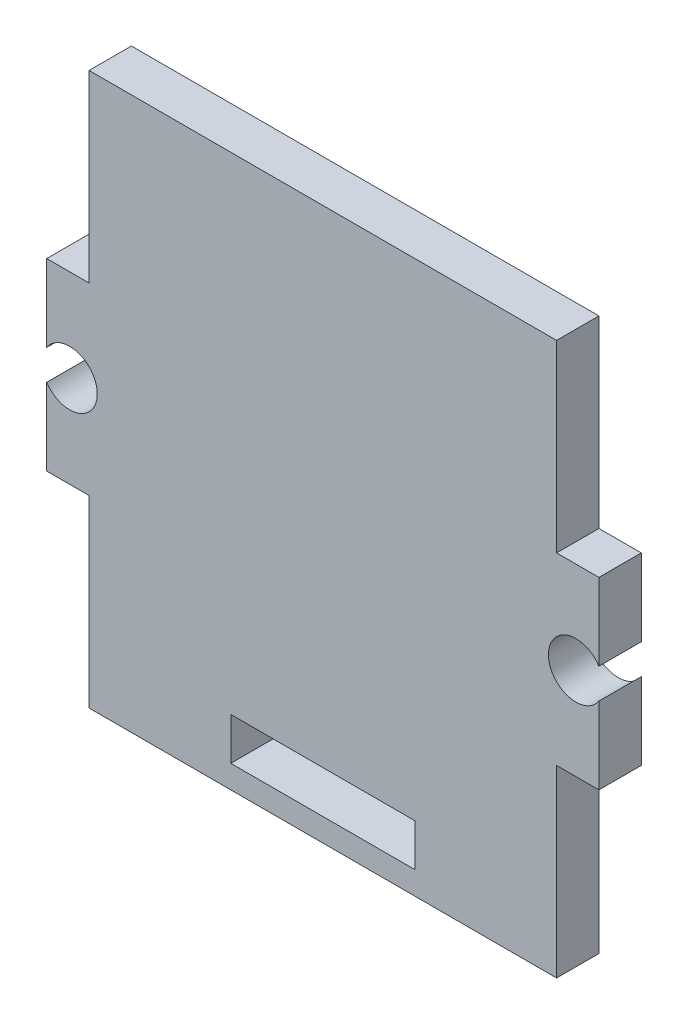
from build123d import *

# Parameters (mm, degrees)
SKETCH1_W             = 38.1
SKETCH1_H             = 38.1
BOSS_EXTRUDE1_DEPTH   = 2.921
SKETCH2_W             = 12.7
SKETCH2_H             = 2.921
CUT_EXTRUDE1_DEPTH    = 53.851725584
SKETCH3_W             = 2.921
SKETCH3_H             = 12.7
CUT_EXTRUDE2_DEPTH    = 53.851725584
F_6_CLEARANCE_HOLE2_D = 3.7973


with BuildPart() as part:
    # Sketch1 → Boss-Extrude1 (new body)
    with BuildSketch(Plane.XY):
        with Locations((-19.05, 17.4625)):
            Rectangle(SKETCH1_W, SKETCH1_H)
    extrude(amount=-BOSS_EXTRUDE1_DEPTH)

    # Sketch2 → Cut-Extrude1 (cut, through all)
    with BuildSketch(Plane.XY):
        with Locations((-19.05, 1.4605)):
            Rectangle(SKETCH2_W, SKETCH2_H)
    extrude(amount=-CUT_EXTRUDE1_DEPTH, mode=Mode.SUBTRACT)

    # Sketch3 → Cut-Extrude2 (cut, through all)
    with BuildSketch(Plane.XY):
        with Locations((-1.4605, 4.7625)):
            Rectangle(SKETCH3_W, SKETCH3_H)
        with Locations((-1.4605, 30.1625)):
            Rectangle(SKETCH3_W, SKETCH3_H)
        with Locations((-36.6395, 30.1625)):
            Rectangle(SKETCH3_W, SKETCH3_H)
        with Locations((-36.6395, 4.7625)):
            Rectangle(SKETCH3_W, SKETCH3_H)
    extrude(amount=-CUT_EXTRUDE2_DEPTH, mode=Mode.SUBTRACT)

    # #6 Clearance Hole2 (through all)
    with Locations(Plane.XY):
        with Locations((-1.5875, 17.4625), (-36.5125, 17.4625)):
            Hole(F_6_CLEARANCE_HOLE2_D / 2)


solid = part.part
